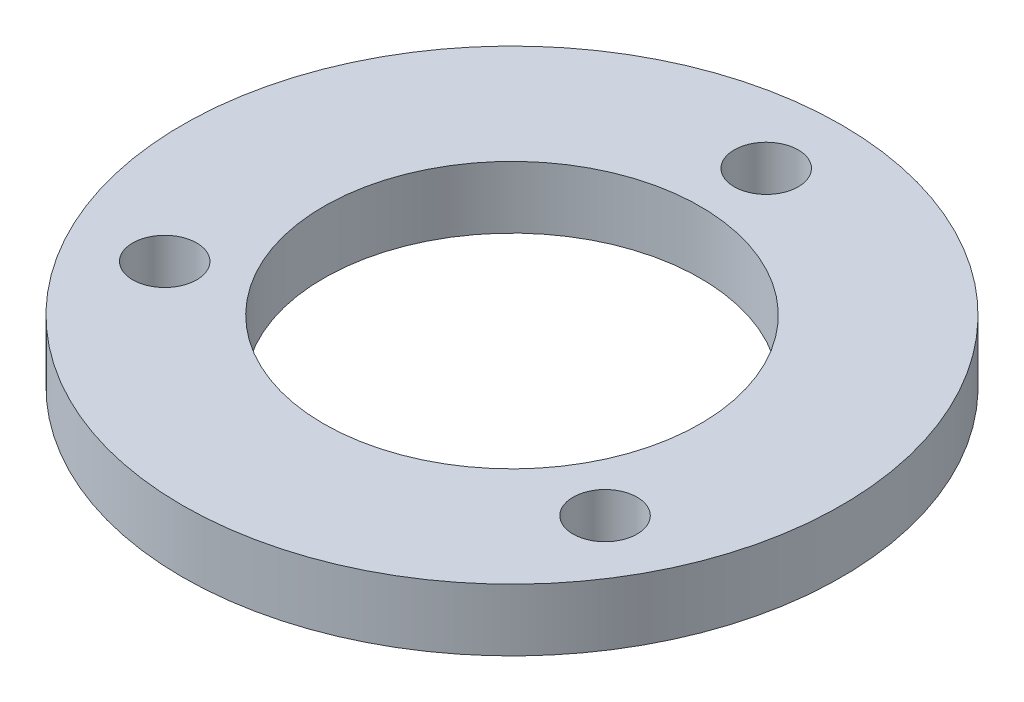
from build123d import *

# Parameters (mm, degrees)
SKETCH_1_R      = 17.5
SKETCH_1_R_2    = 10
SKETCH_1_R_3    = 1.7
EXTRUDE_1_DEPTH = 3.3


with BuildPart() as part:
    # 草图1 → 凸台-拉伸1 (new body)
    with BuildSketch(Plane(origin=(0, 0, 0), x_dir=(1, 0, 0), z_dir=(0, 1, 0))):
        with Locations(Location((0, 0, 0), (0, 0, 270))):
            Circle(SKETCH_1_R)
        with Locations(Location((0, 0, 0), (0, 0, 270))):
            Circle(SKETCH_1_R_2, mode=Mode.SUBTRACT)
        with Locations(Location((0, 13.5, 0), (0, 0, 270))):
            Circle(SKETCH_1_R_3, mode=Mode.SUBTRACT)
        with Locations(Location((11.691342951, -6.75, 0), (0, 0, 270))):
            Circle(SKETCH_1_R_3, mode=Mode.SUBTRACT)
        with Locations(Location((-11.691342951, -6.75, 0), (0, 0, 270))):
            Circle(SKETCH_1_R_3, mode=Mode.SUBTRACT)
    extrude(amount=EXTRUDE_1_DEPTH)


solid = part.part
